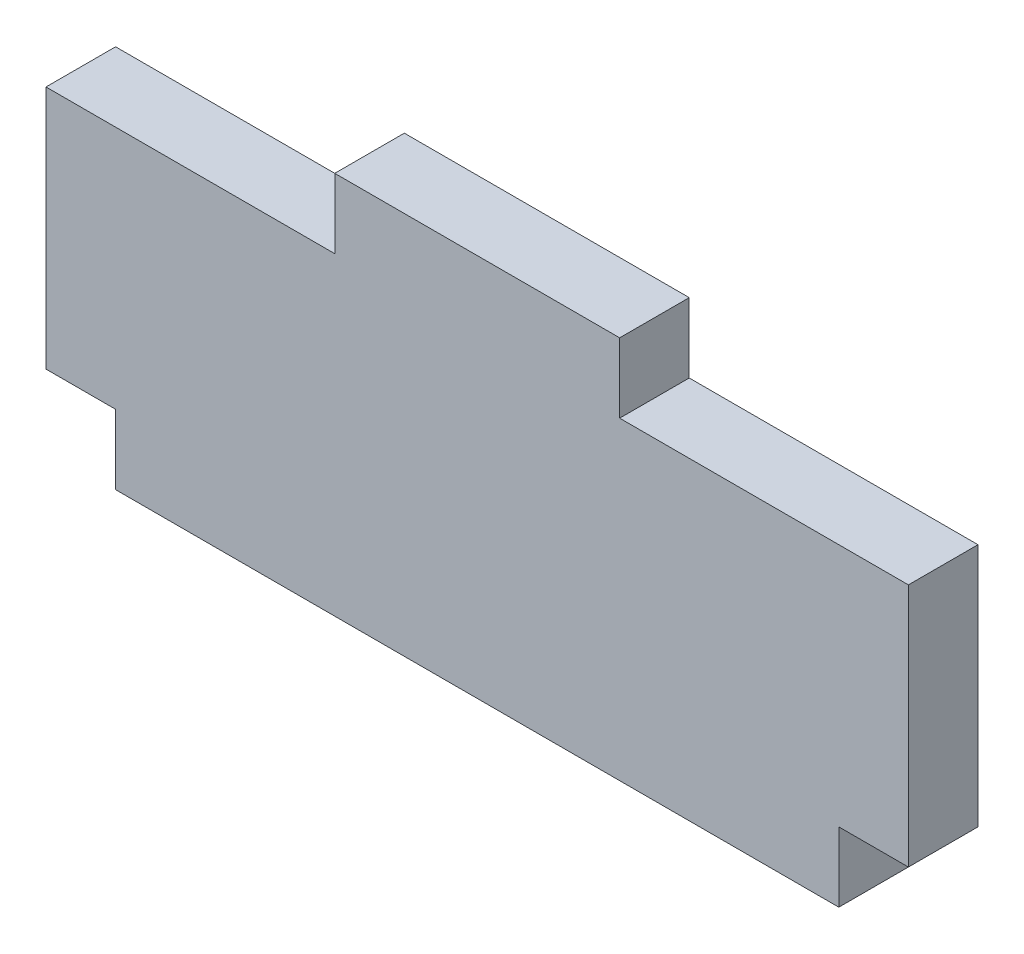
from build123d import *

# Parameters (mm, degrees)
BOSS_EXTRUDE1_DEPTH = 6.35


with BuildPart() as part:
    # Sketch1 → Boss-Extrude1 (new body)
    with BuildSketch(Plane.XY):
        Polygon((0, 0), (26.35, 0), (26.35, 6.35), (52.35, 6.35), (52.35, 0), (78.7, 0), (78.7, -22.3), (72.35, -22.3), (72.35, -28.65), (6.35, -28.65), (6.35, -22.3), (0, -22.3), align=None)
    extrude(amount=BOSS_EXTRUDE1_DEPTH)


solid = part.part
